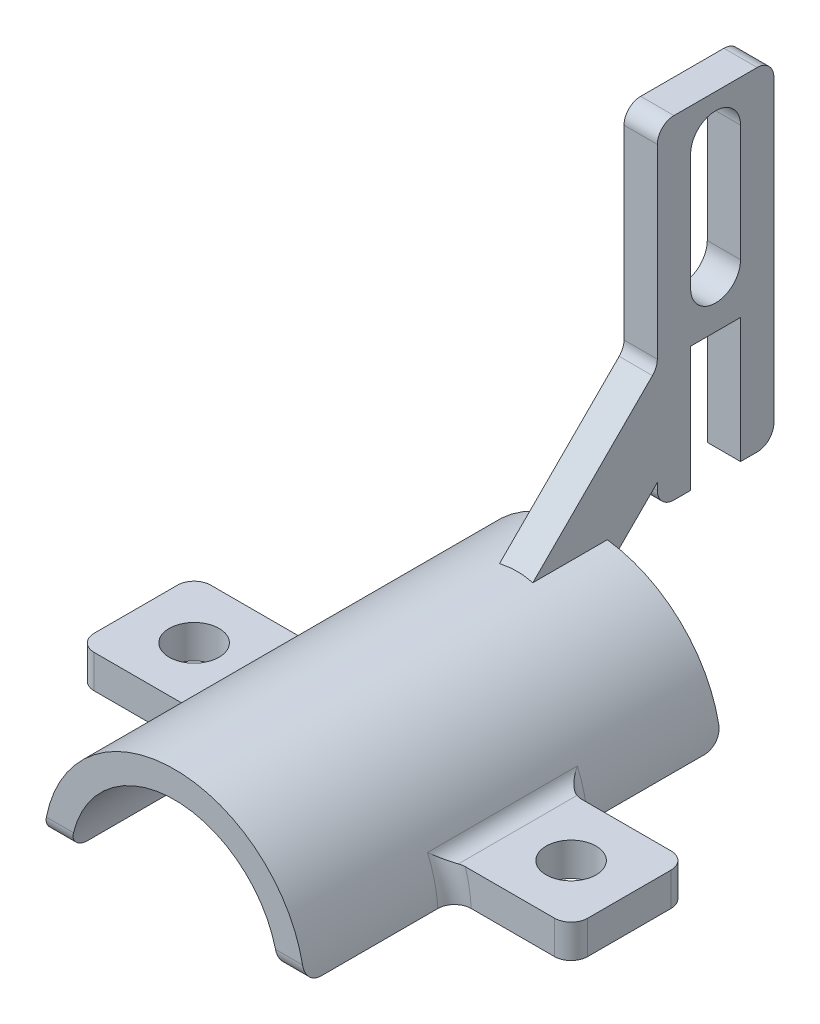
from build123d import *

# Parameters (mm, degrees)
BOSS_EXTRUDE1_DEPTH      = 12.5
BOSS_EXTRUDE3_REACH      = 29.026
BOSS_EXTRUDE3_END_RADIUS = 7.8375
SKETCH5_W                = 7
SKETCH5_H                = 2
SKETCH6_R                = 1.5
CUT_EXTRUDE2_DEPTH       = 2
FILLET2_R                = 1
FILLET2_OF_MIRROR2_R     = 1
BOSS_EXTRUDE4_DEPTH      = 1
SKETCH11_W               = 3
SKETCH11_H               = 7.5
CUT_EXTRUDE4_DEPTH       = 40.134350283
FILLET3_R                = 1


with BuildPart() as part:
    # Sketch1 → Boss-Extrude1 (new, symmetric)
    with BuildSketch(Plane.XY):
        with BuildLine():
            Line((-7.821534776, 0.5), (-6.229967897, 0.5))
            ThreePointArc((-6.229967897, 0.5), (0, 6.25), (6.229967897, 0.5))
            Line((6.229967897, 0.5), (7.821534776, 0.5))
            ThreePointArc((7.821534776, 0.5), (0, 7.8375), (-7.821534776, 0.5))
        make_face()
    extrude(amount=BOSS_EXTRUDE1_DEPTH, both=True)

    # Boss-Extrude3: up to this cylinder (the profile starts outside it)
    boss_extrude3_end = Plane(origin=(0, 0, 0), z_dir=(0, 0, -1)) * Cylinder(BOSS_EXTRUDE3_END_RADIUS, 74.727, mode=Mode.PRIVATE)
    # Sketch5 → Boss-Extrude3 (add, up to the surface)
    with BuildSketch(Plane(origin=(14.821534776, 0, 0), x_dir=(0, 0, -1), z_dir=(1, 0, 0)), mode=Mode.PRIVATE) as boss_extrude3_sk1:
        with Locations((0, 1.5)):
            Rectangle(SKETCH5_W, SKETCH5_H)
    boss_extrude3_tool1 = extrude(boss_extrude3_sk1.sketch, amount=-BOSS_EXTRUDE3_REACH, mode=Mode.PRIVATE) - boss_extrude3_end
    boss_extrude3 = boss_extrude3_tool1.solids().sort_by_distance((14.821535, 1.5, 0))[0]
    add(boss_extrude3)

    # Sketch6 → Cut-Extrude2 (cut)
    with BuildSketch(Plane(origin=(0, 2.5, 0), x_dir=(1, 0, 0), z_dir=(0, 1, 0))):
        with Locations(Location((11.321534776, 0, 0), (0, 0, 270))):
            Circle(SKETCH6_R)
    cut_extrude2 = extrude(amount=-CUT_EXTRUDE2_DEPTH, mode=Mode.SUBTRACT)

    # Fillet2
    fillet2_edges = [part.edges().sort_by_distance(p)[0] for p in [
        (14.821534776, 1.5, 3.5),
        (14.821534776, 1.5, -3.5),
        (7.690104358, 1.512845405, -3.5),
        (7.428082273, 2.5, 0),
        (7.690104358, 1.512845405, 3.5),
    ]]
    fillet(fillet2_edges, radius=FILLET2_R)

    # Mirror2: Boss-Extrude3, Cut-Extrude2 across plane
    add(boss_extrude3.mirror(Plane(origin=(0, 0, 0), x_dir=(0, 0, 1), z_dir=(1, 0, 0))))
    add(cut_extrude2.mirror(Plane(origin=(0, 0, 0), x_dir=(0, 0, 1), z_dir=(1, 0, 0))), mode=Mode.SUBTRACT)

    # Fillet2 of Mirror2
    fillet2_of_mirror2_edges = [part.edges().sort_by_distance(p)[0] for p in [
        (-14.821534776, 1.5, 3.5),
        (-14.821534776, 1.5, -3.5),
        (-7.690104358, 1.512845405, -3.5),
        (-7.428082273, 2.5, 0),
        (-7.690104358, 1.512845405, 3.5),
    ]]
    fillet(fillet2_of_mirror2_edges, radius=FILLET2_OF_MIRROR2_R)

    # Sketch8 → Boss-Extrude4 (add, symmetric)
    with BuildSketch(Plane(origin=(0, 0, 0), x_dir=(0, 0, -1), z_dir=(1, 0, 0))):
        Polygon((12.5, 6.25), (15.5, 9.25), (15.5, 7.8375), (22.5, 7.8375), (22.5, 27.8375), (15.5, 27.8375), (15.5, 15.25), (6.5, 6.25), align=None)
    extrude(amount=BOSS_EXTRUDE4_DEPTH, both=True)

    # Sketch11 → Cut-Extrude4 (cut, through all)
    with BuildSketch(Plane(origin=(1, 0, 0), x_dir=(0, 0, -1), z_dir=(1, 0, 0))):
        with BuildLine():
            Line((20.5, 25.3375), (20.5, 18.3375))
            ThreePointArc((20.5, 18.3375), (19, 16.8375), (17.5, 18.3375))
            Line((17.5, 18.3375), (17.5, 25.3375))
            ThreePointArc((17.5, 25.3375), (19, 26.8375), (20.5, 25.3375))
        make_face()
        with Locations((19, 11.5875)):
            Rectangle(SKETCH11_W, SKETCH11_H)
    extrude(amount=-CUT_EXTRUDE4_DEPTH, mode=Mode.SUBTRACT)

    # Fillet3
    fillet3_edges = [part.edges().sort_by_distance(p)[0] for p in [
        (0, 15.25, -15.5),
        (0, 7.8375, -15.5),
        (0, 7.8375, -22.5),
        (0, 27.8375, -22.5),
        (0, 27.8375, -15.5),
        (-7.025751337, 0.5, 12.5),
        (-7.025751337, 0.5, -12.5),
        (7.025751337, 0.5, -12.5),
        (7.025751337, 0.5, 12.5),
    ]]
    fillet(fillet3_edges, radius=FILLET3_R)


solid = part.part
